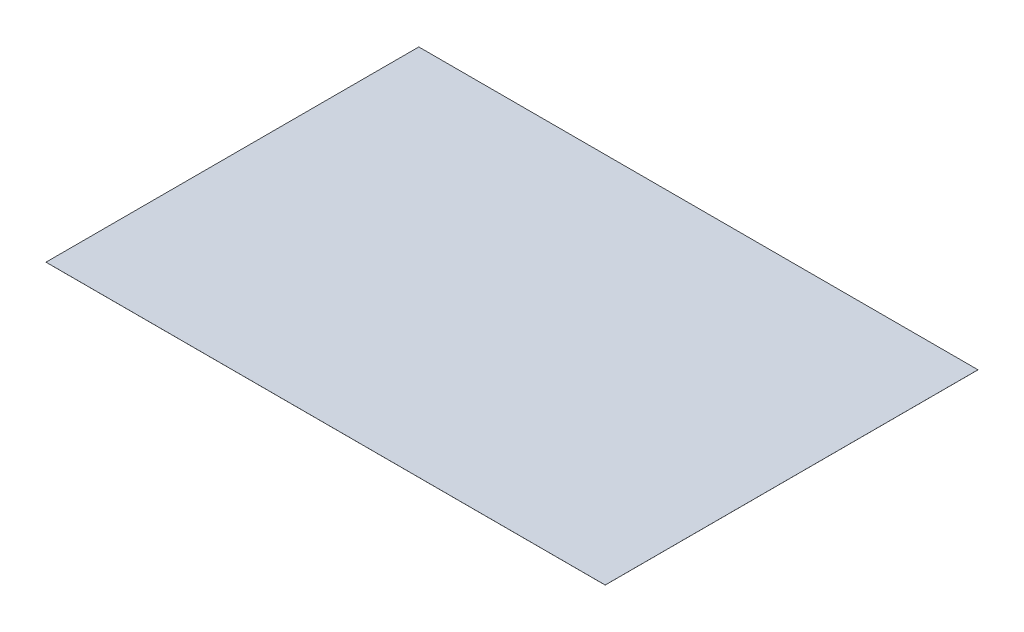
from build123d import *

# Parameters (mm, degrees)
CROQUIS1_W              = 600
CROQUIS1_H              = 400
SALIENTE_EXTRUIR1_DEPTH = 0.05


with BuildPart() as part:
    # Croquis1 → Saliente-Extruir1 (new body)
    with BuildSketch(Plane(origin=(0, 0, 0), x_dir=(1, 0, 0), z_dir=(0, 1, 0))):
        Rectangle(CROQUIS1_W, CROQUIS1_H)
    extrude(amount=SALIENTE_EXTRUIR1_DEPTH)


solid = part.part
